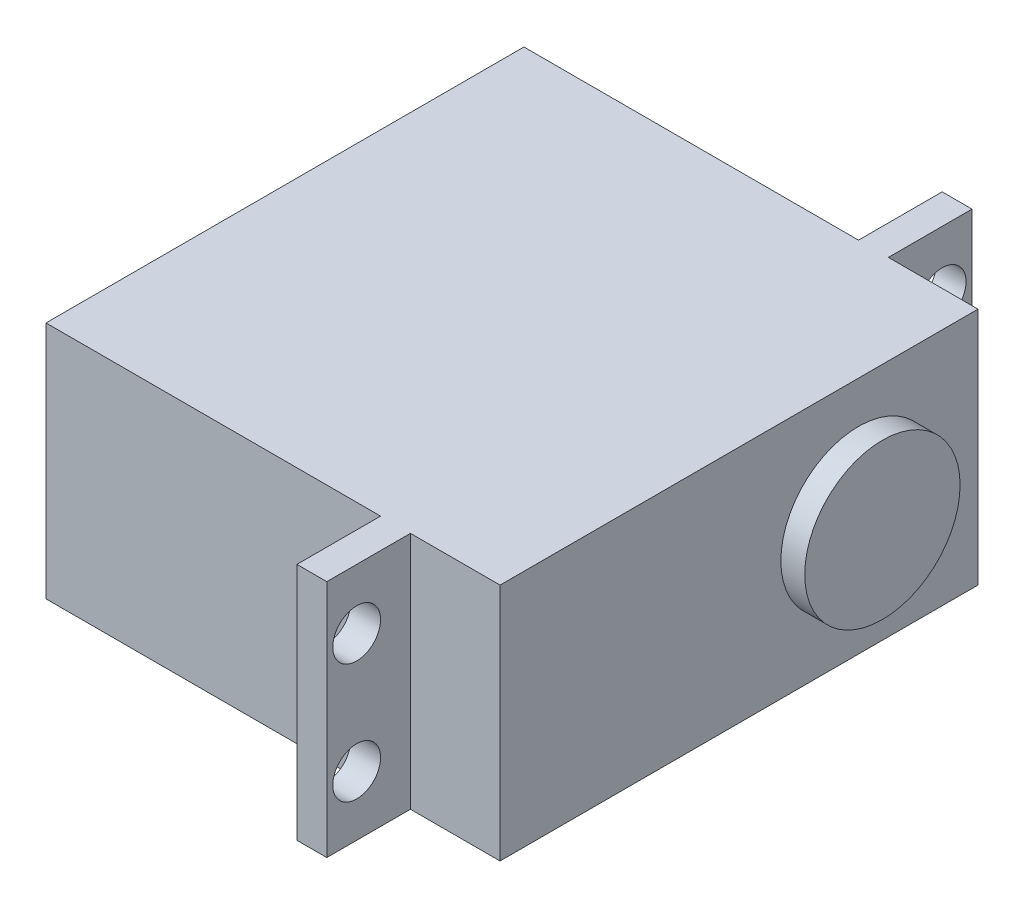
from build123d import *

# Parameters (mm, degrees)
BOSS_EXTRUDE1_DEPTH = 20
SKETCH2_R           = 2
CUT_EXTRUDE1_DEPTH  = 2.5
SKETCH3_R           = 6.5
BOSS_EXTRUDE2_DEPTH = 2


with BuildPart() as part:
    # Sketch1 → Boss-Extrude1 (new body)
    with BuildSketch(Plane(origin=(0, 0, 0), x_dir=(1, 0, 0), z_dir=(0, 1, 0))):
        Polygon((11.5, 20), (19, 20), (19, -20), (11.5, -20), (11.5, -27), (9, -27), (9, -20), (-19, -20), (-19, 20), (9, 20), (9, 27), (11.5, 27), align=None)
    extrude(amount=BOSS_EXTRUDE1_DEPTH)

    # Sketch2 → Cut-Extrude1 (cut)
    with BuildSketch(Plane(origin=(11.5, 0, 0), x_dir=(0, 0, -1), z_dir=(1, 0, 0))):
        with Locations((-24.5, 15)):
            Circle(SKETCH2_R)
        with Locations((-24.5, 5)):
            Circle(SKETCH2_R)
        with Locations((24.5, 5)):
            Circle(SKETCH2_R)
        with Locations((24.5, 15)):
            Circle(SKETCH2_R)
    extrude(amount=-CUT_EXTRUDE1_DEPTH, mode=Mode.SUBTRACT)

    # Sketch3 → Boss-Extrude2 (add)
    with BuildSketch(Plane(origin=(19, 0, 0), x_dir=(0, 0, -1), z_dir=(1, 0, 0))):
        with Locations(Location((10, 10, 0), (0, 0, 180))):
            Circle(SKETCH3_R)
    extrude(amount=BOSS_EXTRUDE2_DEPTH)


solid = part.part
